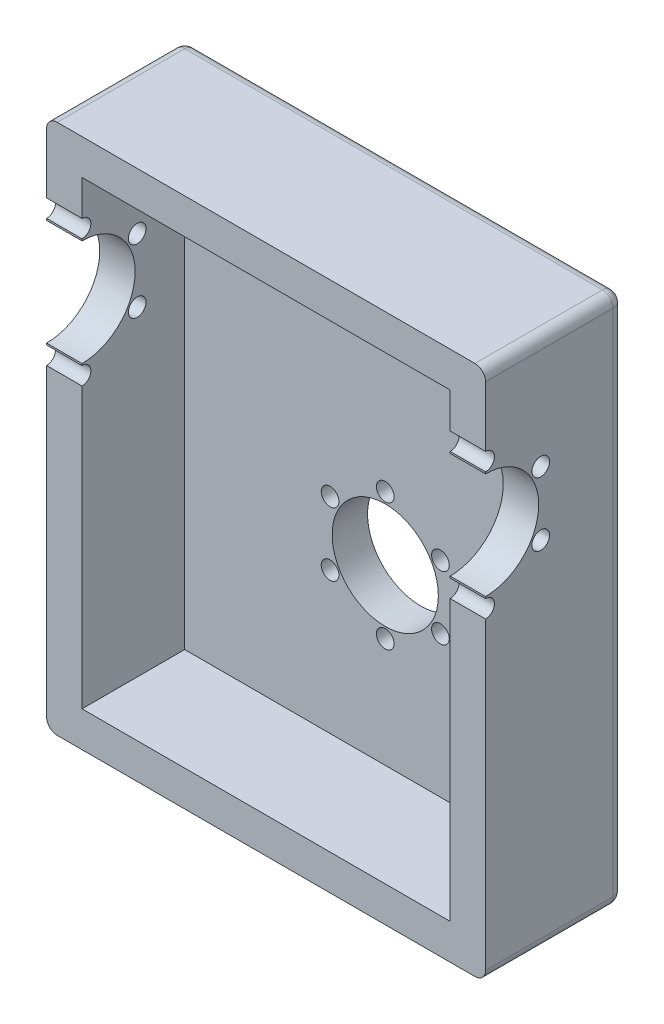
from build123d import *

# Parameters (mm, degrees)
SKETCH1_W               = 124
SKETCH1_H               = 150
SKETCH1_W_2             = 104
SKETCH1_H_2             = 130
BOSS_EXTRUDE1_DEPTH     = 29
SKETCH2_W               = 124
SKETCH2_H               = 150
BOSS_EXTRUDE2_DEPTH     = 10
CUT_EXTRUDE1_DEPTH      = 105.833200848
CUT_EXTRUDE1_DEPTH_BACK = 105.833200848
SKETCH3_R               = 15
SKETCH3_R_2             = 2.5
CUT_EXTRUDE2_DEPTH      = 148.79039211
CUT_EXTRUDE2_DEPTH_BACK = 148.79039211
SKETCH4_R               = 15
SKETCH4_R_2             = 2.5
FILLET1_R               = 3


with BuildPart() as part:
    # Sketch1 → Boss-Extrude1 (new body)
    with BuildSketch(Plane.XY):
        Rectangle(SKETCH1_W, SKETCH1_H)
        Rectangle(SKETCH1_W_2, SKETCH1_H_2, mode=Mode.SUBTRACT)
    extrude(amount=BOSS_EXTRUDE1_DEPTH)

    # Sketch2 → Boss-Extrude2 (add)
    with BuildSketch(Plane(origin=(0, 0, 0), x_dir=(-1, 0, 0), z_dir=(0, 0, -1))):
        Rectangle(SKETCH2_W, SKETCH2_H)
    extrude(amount=BOSS_EXTRUDE2_DEPTH)

    # Sketch3 → Cut-Extrude1 (cut, two sides: drawn at the far end of the back side and taken through both)
    with BuildSketch(Plane(origin=(0, 0, -10), x_dir=(-1, 0, 0), z_dir=(0, 0, -1)).offset(-CUT_EXTRUDE1_DEPTH_BACK)):
        with Locations(Location((-4.66, -16.02, 0), (0, 0, 180))):
            Circle(SKETCH3_R)
        with Locations(Location((-4.66, 1.98, 0), (0, 0, 180))):
            Circle(SKETCH3_R_2)
        with Locations(Location((10.928457268, -7.02, 0), (0, 0, 180))):
            Circle(SKETCH3_R_2)
        with Locations(Location((10.928457268, -25.02, 0), (0, 0, 180))):
            Circle(SKETCH3_R_2)
        with Locations(Location((-4.66, -34.02, 0), (0, 0, 180))):
            Circle(SKETCH3_R_2)
        with Locations(Location((-20.248457268, -25.02, 0), (0, 0, 180))):
            Circle(SKETCH3_R_2)
        with Locations(Location((-20.248457268, -7.02, 0), (0, 0, 180))):
            Circle(SKETCH3_R_2)
    extrude(amount=CUT_EXTRUDE1_DEPTH + CUT_EXTRUDE1_DEPTH_BACK, mode=Mode.SUBTRACT)

    # Sketch4 → Cut-Extrude2 (cut, two sides: drawn at the far end of the back side and taken through both)
    with BuildSketch(Plane.ZY.offset(62).offset(-CUT_EXTRUDE2_DEPTH_BACK)):
        with Locations((29, 34.48)):
            Circle(SKETCH4_R)
        with Locations((29, 52.48)):
            Circle(SKETCH4_R_2)
        with Locations((44.588457268, 43.48)):
            Circle(SKETCH4_R_2)
        with Locations((44.588457268, 25.48)):
            Circle(SKETCH4_R_2)
        with Locations((29, 16.48)):
            Circle(SKETCH4_R_2)
        with Locations(Location((13.411542732, 25.48, 0), (0, 0, 270))):
            Circle(SKETCH4_R_2)
        with Locations(Location((13.411542732, 43.48, 0), (0, 0, 270))):
            Circle(SKETCH4_R_2)
    extrude(amount=CUT_EXTRUDE2_DEPTH + CUT_EXTRUDE2_DEPTH_BACK, mode=Mode.SUBTRACT)

    # Fillet1
    fillet1_edges = [part.edges().sort_by_distance(p)[0] for p in [
        (0, 75, -10),
        (62, 0, -10),
        (0, -75, -10),
        (-62, 0, -10),
        (62, -75, 9.5),
        (-62, -75, 9.5),
        (-62, 75, 9.5),
        (62, 75, 9.5),
    ]]
    fillet(fillet1_edges, radius=FILLET1_R)


solid = part.part
